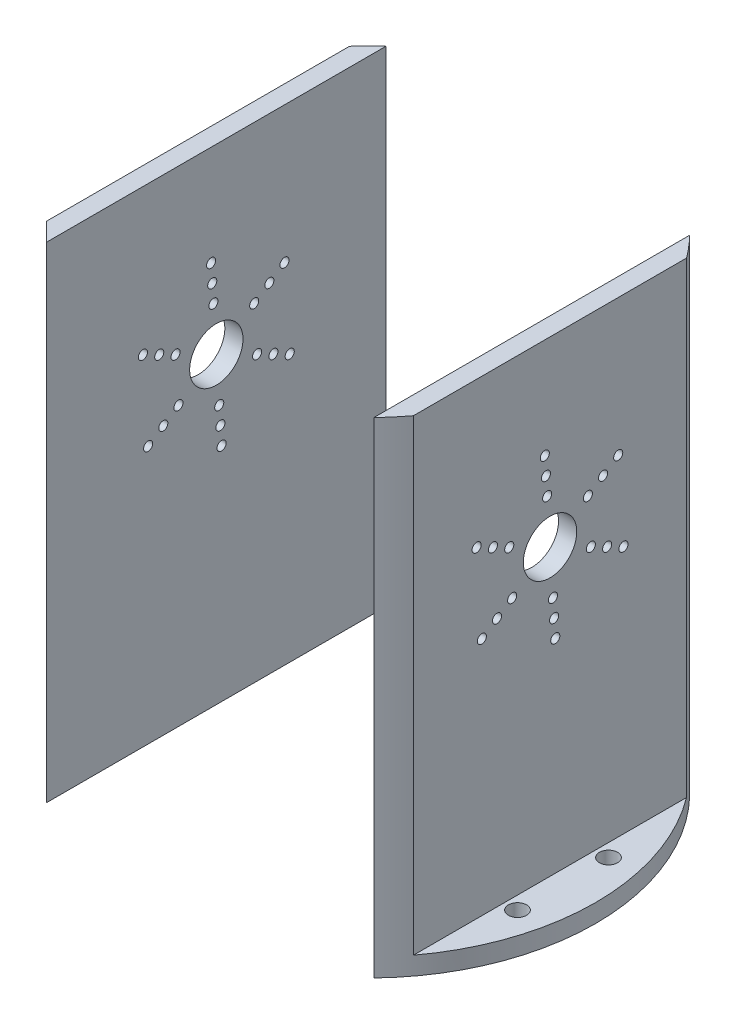
from build123d import *

# Parameters (mm, degrees)
BOSS_EXTRUDE1_DEPTH     = 3
BOSS_EXTRUDE2_DEPTH     = 80
SKETCH8_R               = 1.5
CUT_EXTRUDE2_DEPTH      = 3
CUT_EXTRUDE3_DEPTH      = 107.496478815
CUT_EXTRUDE3_DEPTH_BACK = 107.496478815
SKETCH7_R               = 0.75
SKETCH7_R_2             = 0.752346506


with BuildPart() as part:
    # Sketch1 → Boss-Extrude1 (new body)
    with BuildSketch(Plane(origin=(0, 0, 0), x_dir=(1, 0, 0), z_dir=(0, 1, 0))):
        with BuildLine():
            Line((-28, 0), (-28, 24.944939367))
            ThreePointArc((-28, 24.944939367), (-37.5, 0), (-28, -24.944939367))
            Line((-28, -24.944939367), (-28, 0))
        make_face()
        with BuildLine():
            Line((-25, -27.950849719), (-25, 0))
            Line((-25, 0), (-25, 27.950849719))
            ThreePointArc((-25, 27.950849719), (-26.542586051, 26.490396859), (-28, 24.944939367))
            Line((-28, 24.944939367), (-28, 0))
            Line((-28, 0), (-28, -24.944939367))
            ThreePointArc((-28, -24.944939367), (-26.542586051, -26.490396859), (-25, -27.950849719))
        make_face()
        with BuildLine():
            ThreePointArc((37.5, 0), (35.575623677, 11.858541226), (30, 22.5))
            Line((30, 22.5), (30, -22.5))
            ThreePointArc((30, -22.5), (35.575623677, -11.858541226), (37.5, 0))
        make_face()
        with BuildLine():
            ThreePointArc((30, 22.5), (28.554416335, 24.308338236), (27, 26.024027359))
            Line((27, 26.024027359), (27, -26.024027359))
            ThreePointArc((27, -26.024027359), (28.554416335, -24.308338236), (30, -22.5))
            Line((30, -22.5), (30, 22.5))
        make_face()
    extrude(amount=BOSS_EXTRUDE1_DEPTH)

    # Sketch1<3> → Boss-Extrude2 (add)
    with BuildSketch(Plane(origin=(0, 0, 0), x_dir=(1, 0, 0), z_dir=(0, 1, 0))):
        with BuildLine():
            Line((-25, -27.950849719), (-25, 0))
            Line((-25, 0), (-25, 27.950849719))
            ThreePointArc((-25, 27.950849719), (-26.542586051, 26.490396859), (-28, 24.944939367))
            Line((-28, 24.944939367), (-28, 0))
            Line((-28, 0), (-28, -24.944939367))
            ThreePointArc((-28, -24.944939367), (-26.542586051, -26.490396859), (-25, -27.950849719))
        make_face()
        with BuildLine():
            ThreePointArc((30, 22.5), (28.554416335, 24.308338236), (27, 26.024027359))
            Line((27, 26.024027359), (27, -26.024027359))
            ThreePointArc((27, -26.024027359), (28.554416335, -24.308338236), (30, -22.5))
            Line((30, -22.5), (30, 22.5))
        make_face()
    extrude(amount=BOSS_EXTRUDE2_DEPTH)

    # Sketch8 → Cut-Extrude2 (cut)
    with BuildSketch(Plane(origin=(0, 3, 0), x_dir=(1, 0, 0), z_dir=(0, 1, 0))):
        with Locations(Location((-32.136427928, -7.5, 0), (0, 0, 270))):
            Circle(SKETCH8_R)
        with Locations(Location((32.136427928, -7.5, 0), (0, 0, 270))):
            Circle(SKETCH8_R)
        with Locations(Location((32.136427928, 7.5, 0), (0, 0, 270))):
            Circle(SKETCH8_R)
        with Locations(Location((-32.136427928, 7.5, 0), (0, 0, 270))):
            Circle(SKETCH8_R)
    extrude(amount=-CUT_EXTRUDE2_DEPTH, mode=Mode.SUBTRACT)

    # Sketch7 → Cut-Extrude3 (cut, two sides: drawn at the far end of the back side and taken through both)
    with BuildSketch(Plane.ZY.offset(-27).offset(-CUT_EXTRUDE3_DEPTH_BACK)):
        with Locations((0.671346916, 60.478515797)):
            Circle(SKETCH7_R)
        with BuildLine():
            ThreePointArc((4.4, 50), (0, 54.4), (-4.4, 50))
            Line((-4.4, 50), (4.4, 50))
        make_face()
        with BuildLine():
            Line((4.4, 50), (-4.4, 50))
            ThreePointArc((-4.4, 50), (0, 45.6), (4.4, 50))
        make_face()
        with Locations((0.479533512, 57.484654141)):
            Circle(SKETCH7_R)
        with Locations((6.721667381, 53.327038867)):
            Circle(SKETCH7_R)
        with Locations((9.410334333, 54.657854414)):
            Circle(SKETCH7_R)
        with Locations((12.099001285, 55.988669961)):
            Circle(SKETCH7_R)
        with Locations((0.863160321, 63.472377454)):
            Circle(SKETCH7_R)
        with Locations((-8.738987416, 55.820661383)):
            Circle(SKETCH7_R)
        with Locations((-6.242133869, 54.157615274)):
            Circle(SKETCH7_R)
        with Locations((-11.235840964, 57.483707492)):
            Circle(SKETCH7_R)
        with Locations((-12.099001285, 44.011330039)):
            Circle(SKETCH7_R)
        with Locations((-9.410334333, 45.342145586)):
            Circle(SKETCH7_R)
        with Locations((-6.721667381, 46.672961133)):
            Circle(SKETCH7_R)
        with Locations((-0.479533512, 42.515345859)):
            Circle(SKETCH7_R)
        with Locations((-0.671346916, 39.521484203)):
            Circle(SKETCH7_R)
        with Locations((-0.863160321, 36.527622546)):
            Circle(SKETCH7_R_2)
        with Locations((11.235840964, 42.516292508)):
            Circle(SKETCH7_R)
        with Locations((8.738987416, 44.179338617)):
            Circle(SKETCH7_R)
        with Locations((6.242133869, 45.842384726)):
            Circle(SKETCH7_R)
    extrude(amount=CUT_EXTRUDE3_DEPTH + CUT_EXTRUDE3_DEPTH_BACK, mode=Mode.SUBTRACT)


solid = part.part
